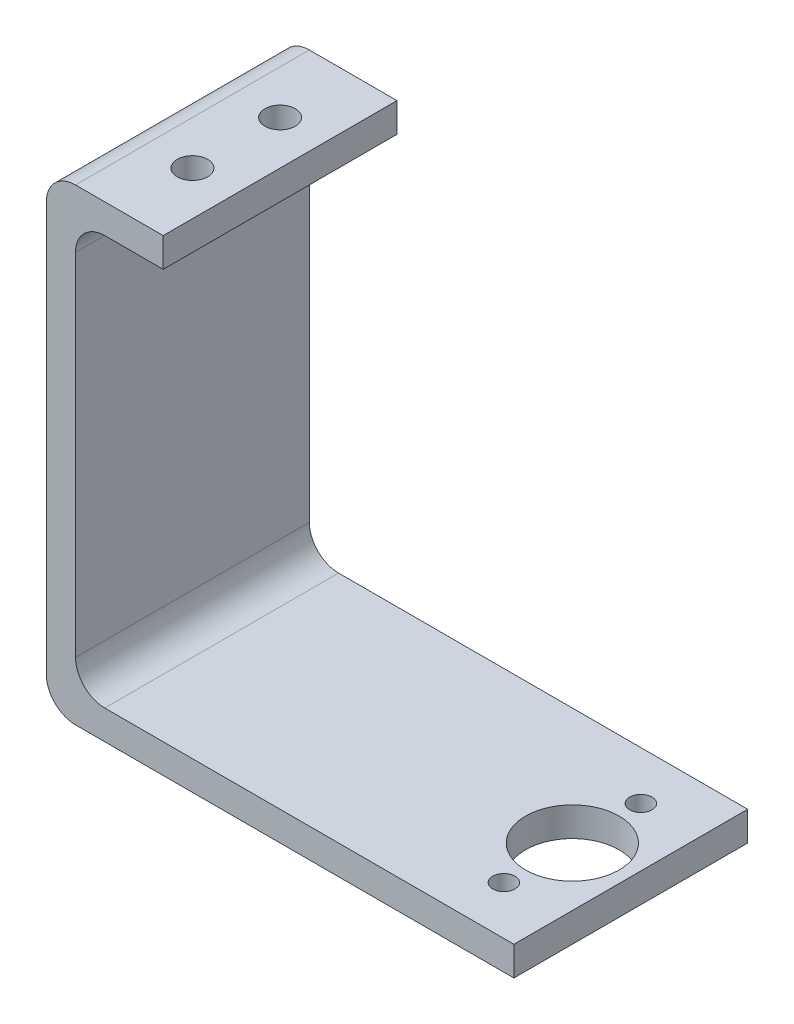
from build123d import *

# Parameters (mm, degrees)
BOSS_EXTRUDE1_DEPTH       = 25.4
M4X0_7_TAPPED_HOLE1_D     = 3.3
M4X0_7_TAPPED_HOLE1_DEPTH = 9.906
M4X0_7_TAPPED_HOLE1_TIP   = 0.991420021
CUT_EXTRUDE1_REACH        = 66.12
SKETCH7_R                 = 5.08
SKETCH7_R_2               = 1.2065
FILLET1_R                 = 3.175
FILLET2_R                 = 3.175


with BuildPart() as part:
    # Sketch1 → Boss-Extrude1 (new body)
    with BuildSketch(Plane.XY):
        Polygon((-17.059275079, 26.987213855), (-29.759275079, 26.987213855), (-29.759275079, -23.812786145), (21.040724921, -23.812786145), (21.040724921, -20.637786145), (-26.584275079, -20.637786145), (-26.584275079, 23.812213855), (-17.059275079, 23.812213855), align=None)
    extrude(amount=BOSS_EXTRUDE1_DEPTH)

    # M4x0.7 Tapped Hole1
    with Locations(Plane(origin=(0, 26.987213855, 0), x_dir=(1, 0, 0), z_dir=(0, 1, 0))):
        with Locations((-21.821775079, -7.9375), (-21.821775079, -17.4625)):
            Hole(M4X0_7_TAPPED_HOLE1_D / 2, depth=M4X0_7_TAPPED_HOLE1_DEPTH)
            with Locations((0, 0, -(M4X0_7_TAPPED_HOLE1_DEPTH + M4X0_7_TAPPED_HOLE1_TIP / 2))):  # 118° drill point
                Cone(0, M4X0_7_TAPPED_HOLE1_D / 2, M4X0_7_TAPPED_HOLE1_TIP, mode=Mode.SUBTRACT)

    # Sketch7 → Cut-Extrude1 (cut, up to next)
    with BuildSketch(Plane.XZ.offset(23.812786145), mode=Mode.PRIVATE) as cut_extrude1_sk1:
        with Locations(Location((14.690724921, 12.7, 0), (0, 0, 270))):
            Circle(SKETCH7_R)
    cut_extrude1_tool1 = extrude(cut_extrude1_sk1.sketch, amount=-CUT_EXTRUDE1_REACH, mode=Mode.PRIVATE) & part.part
    # Sketch7 → Cut-Extrude1 (cut, up to next)
    with BuildSketch(Plane.XZ.offset(23.812786145), mode=Mode.PRIVATE) as cut_extrude1_sk2:
        with Locations(Location((14.690724921, 5.2578, 0), (0, 0, 270))):
            Circle(SKETCH7_R_2)
    cut_extrude1_tool2 = extrude(cut_extrude1_sk2.sketch, amount=-CUT_EXTRUDE1_REACH, mode=Mode.PRIVATE) & part.part
    # Sketch7 → Cut-Extrude1 (cut, up to next)
    with BuildSketch(Plane.XZ.offset(23.812786145), mode=Mode.PRIVATE) as cut_extrude1_sk3:
        with Locations(Location((14.690724921, 20.1422, 0), (0, 0, 270))):
            Circle(SKETCH7_R_2)
    cut_extrude1_tool3 = extrude(cut_extrude1_sk3.sketch, amount=-CUT_EXTRUDE1_REACH, mode=Mode.PRIVATE) & part.part
    add(cut_extrude1_tool1.solids().sort_by_distance((14.690725, -23.812786, 12.7))[0], mode=Mode.SUBTRACT)
    add(cut_extrude1_tool2.solids().sort_by_distance((14.690725, -23.812786, 5.2578))[0], mode=Mode.SUBTRACT)
    add(cut_extrude1_tool3.solids().sort_by_distance((14.690725, -23.812786, 20.1422))[0], mode=Mode.SUBTRACT)

    # Fillet1
    fillet1_edges = [part.edges().sort_by_distance(p)[0] for p in [
        (-29.759275079, -23.812786145, 12.7),
        (-29.759275079, 26.987213855, 12.7),
    ]]
    fillet(fillet1_edges, radius=FILLET1_R)

    # Fillet2
    fillet2_edges = [part.edges().sort_by_distance(p)[0] for p in [
        (-26.584275079, 23.812213855, 12.7),
        (-26.584275079, -20.637786145, 12.7),
    ]]
    fillet(fillet2_edges, radius=FILLET2_R)


solid = part.part
